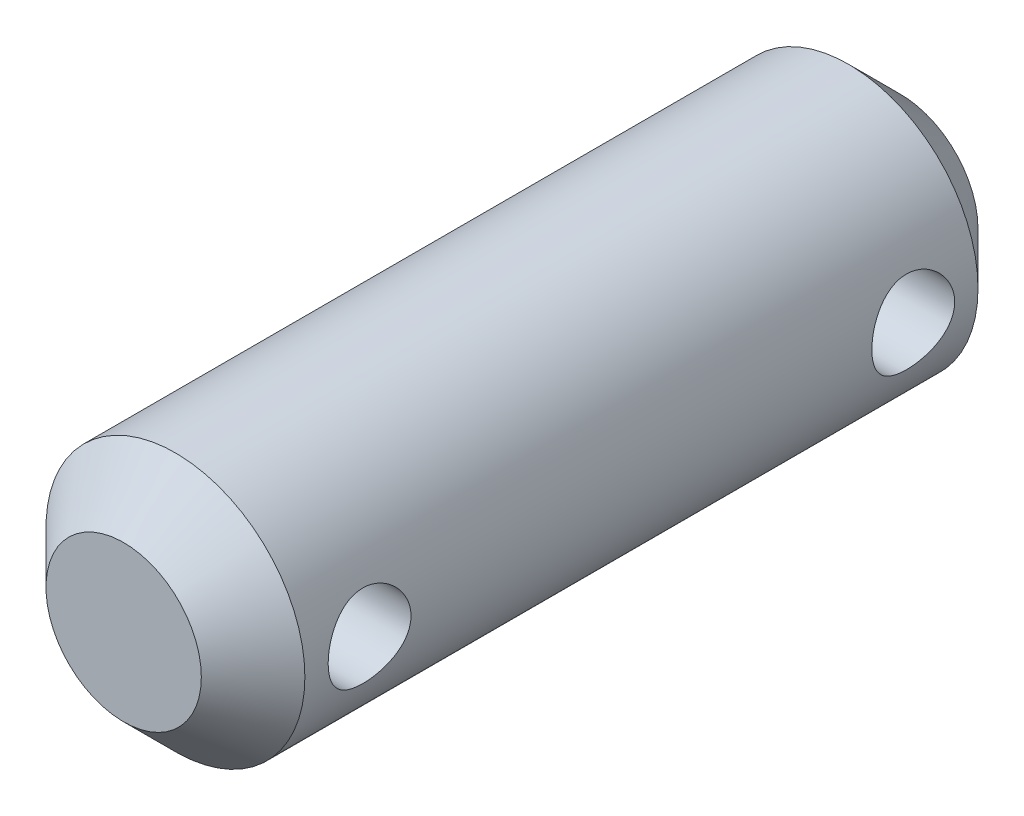
from build123d import *

# Parameters (mm, degrees)
SKETCH1_R               = 5
BASE_EXTRUDE_DEPTH      = 30
CHAMFER1_SIZE           = 2
CUT_EXTRUDE1_DEPTH      = 22.213203436
CUT_EXTRUDE1_DEPTH_BACK = 22.213203436
SKETCH2_R               = 1.6


with BuildPart() as part:
    # Sketch1 → Base-Extrude (new body)
    with BuildSketch(Plane.XY):
        Circle(SKETCH1_R)
    extrude(amount=BASE_EXTRUDE_DEPTH)

    # Chamfer1
    chamfer1_edges = [part.edges().sort_by_distance(p)[0] for p in [
        (-5, 0, 0),
        (-5, 0, 30),
    ]]
    chamfer(chamfer1_edges, length=CHAMFER1_SIZE)

    # Sketch2 → Cut-Extrude1 (cut, two sides: drawn at the far end of the back side and taken through both)
    with BuildSketch(Plane(origin=(0, 0, 10), x_dir=(0, -1, 0), z_dir=(1, 0, 0)).offset(-CUT_EXTRUDE1_DEPTH_BACK)):
        with Locations(Location((0, 5.5, 0), (0, 0, 269.99999999))):
            Circle(SKETCH2_R)
        with Locations(Location((0, -15.5, 0), (0, 0, 180))):
            Circle(SKETCH2_R)
    extrude(amount=CUT_EXTRUDE1_DEPTH + CUT_EXTRUDE1_DEPTH_BACK, mode=Mode.SUBTRACT)


solid = part.part
